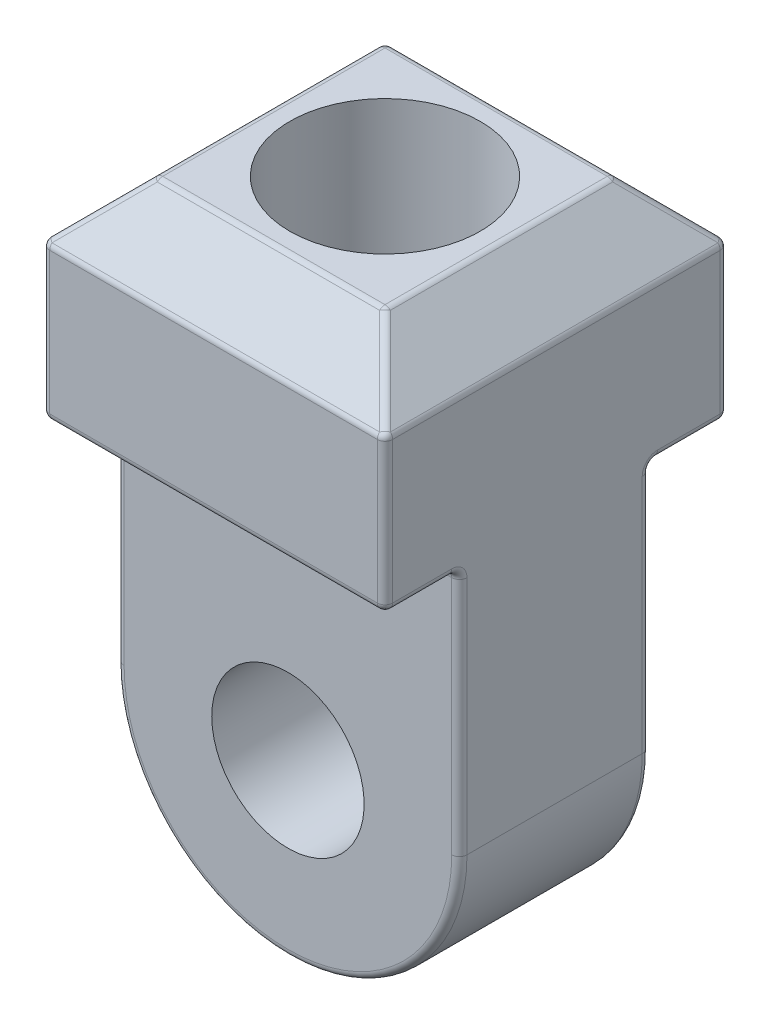
from build123d import *

# Parameters (mm, degrees)
SKETCH1_R               = 2
BOSS_EXTRUDE1_DEPTH     = 4.5
CUT_EXTRUDE1_DEPTH      = 14.583077707
CUT_EXTRUDE1_DEPTH_BACK = 14.583077707
SKETCH2_W               = 2.047747195
SKETCH2_H               = 11
SKETCH2_W_2             = 1.952252805
CUT_EXTRUDE2_DEPTH      = 14.583077707
CUT_EXTRUDE2_DEPTH_BACK = 14.583077707
CUT_EXTRUDE3_DEPTH      = 18.684739184
CUT_EXTRUDE3_DEPTH_BACK = 5
SKETCH4_R               = 2.5
FILLET1_R               = 0.2


with BuildPart() as part:
    # Sketch1 → Boss-Extrude1 (new, symmetric)
    with BuildSketch(Plane.XY):
        with BuildLine():
            Line((-4.5, 0), (-4.5, 10.5))
            Line((-4.5, 10.5), (-3, 12))
            Line((-3, 12), (3, 12))
            Line((3, 12), (4.5, 10.5))
            Line((4.5, 10.5), (4.5, 0))
            ThreePointArc((4.5, 0), (0, -4.5), (-4.5, 0))
        make_face()
        Circle(SKETCH1_R, mode=Mode.SUBTRACT)
    extrude(amount=BOSS_EXTRUDE1_DEPTH, both=True)

    # Sketch2 → Cut-Extrude1 (cut, two sides: drawn at the far end of the back side and taken through both)
    with BuildSketch(Plane(origin=(0, 0, 0), x_dir=(0, 0, -1), z_dir=(1, 0, 0)).offset(-CUT_EXTRUDE1_DEPTH_BACK)):
        with Locations((3.476126403, 1)):
            Rectangle(SKETCH2_W, SKETCH2_H)
        with Locations((-3.523873598, 1)):
            Rectangle(SKETCH2_W_2, SKETCH2_H)
    extrude(amount=CUT_EXTRUDE1_DEPTH + CUT_EXTRUDE1_DEPTH_BACK, mode=Mode.SUBTRACT)

    # Sketch3 → Cut-Extrude2 (cut, two sides: drawn at the far end of the back side and taken through both)
    with BuildSketch(Plane(origin=(0, 0, 0), x_dir=(0, 0, -1), z_dir=(1, 0, 0)).offset(-CUT_EXTRUDE2_DEPTH_BACK)):
        Polygon((-3, 12), (-4.5, 10.5), (-4.5, 12), align=None)
        Polygon((3, 12), (4.5, 10.5), (4.5, 12), align=None)
    extrude(amount=CUT_EXTRUDE2_DEPTH + CUT_EXTRUDE2_DEPTH_BACK, mode=Mode.SUBTRACT)

    # Sketch4 → Cut-Extrude3 (cut, two sides: drawn at the far end of the back side and taken through both)
    with BuildSketch(Plane(origin=(0, 12, 0), x_dir=(1, 0, 0), z_dir=(0, 1, 0)).offset(-CUT_EXTRUDE3_DEPTH_BACK)):
        with Locations(Location((0, 0, 0), (0, 0, 270))):
            Circle(SKETCH4_R)
    extrude(amount=CUT_EXTRUDE3_DEPTH + CUT_EXTRUDE3_DEPTH_BACK, mode=Mode.SUBTRACT)

    # Fillet1
    fillet1_edges = [part.edges().sort_by_distance(p)[0] for p in [
        (-4.5, 10.5, 0),
        (4.5, 10.5, 0),
        (-4.5, 8.5, 4.5),
        (4.5, 8.5, -4.5),
        (4.5, 8.5, 4.5),
        (-4.5, 3.25, -2.452252805),
        (0, -4.5, -2.452252805),
        (0, 6.5, -2.452252805),
        (-4.5, 6.5, -3.476126403),
        (0, 6.5, -4.5),
        (4.5, 3.25, -2.452252805),
        (4.5, 6.5, -3.476126403),
        (0, -4.5, 2.547747195),
        (-4.5, 3.25, 2.547747195),
        (0, 6.5, 2.547747195),
        (0, 6.5, 4.5),
        (-4.5, 6.5, 3.523873597),
        (4.5, 3.25, 2.547747195),
        (4.5, 6.5, 3.523873597),
        (-4.5, 8.5, -4.5),
        (-3, 12, 0),
        (-3.75, 11.25, -3.75),
        (-3.75, 11.25, 3.75),
        (3, 12, 0),
        (0, 10.5, 4.5),
        (0, 12, 3),
        (3.75, 11.25, 3.75),
        (0, 12, -3),
        (0, 10.5, -4.5),
        (3.75, 11.25, -3.75),
    ]]
    fillet(fillet1_edges, radius=FILLET1_R)


solid = part.part
